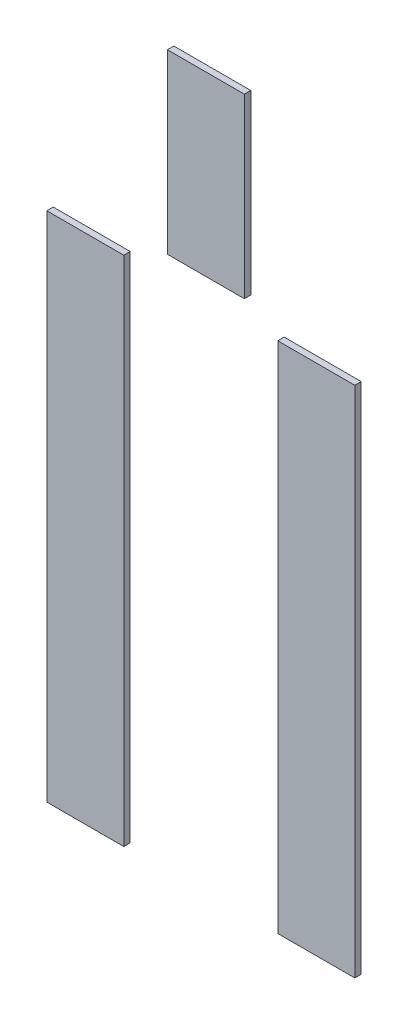
from build123d import *

# Parameters (mm, degrees)
SKETCH_1_W        = 120
SKETCH_1_H        = 800
EXTRUDE_3_DEPTH   = 10
SKETCH_1_H_2      = 798.159300421
EXTRUDE_3_2_DEPTH = 10
SKETCH_1_H_3      = 276.103814445
EXTRUDE_3_3_DEPTH = 10


with BuildPart() as part:
    # Эскиз1 → Бобышка-Вытянуть3 (new body)
    with BuildSketch(Plane.XY):
        with Locations((103.229102796, 35.023040595)):
            Rectangle(SKETCH_1_W, SKETCH_1_H)
    extrude(amount=EXTRUDE_3_DEPTH)


with BuildPart() as body_2:
    # Эскиз1 → Extrude 3 2 (new body)
    with BuildSketch(Plane.XY):
        with Locations((-256.81756222, 31.483242374)):
            Rectangle(SKETCH_1_W, SKETCH_1_H_2)
    extrude(amount=EXTRUDE_3_2_DEPTH)


with BuildPart() as body_3:
    # Эскиз1 → Extrude 3 3 (new body)
    with BuildSketch(Plane.XY):
        with Locations((-68.870529064, 603.812342777)):
            Rectangle(SKETCH_1_W, SKETCH_1_H_3)
    extrude(amount=EXTRUDE_3_3_DEPTH)


solid = Compound([part.part, body_2.part, body_3.part])
